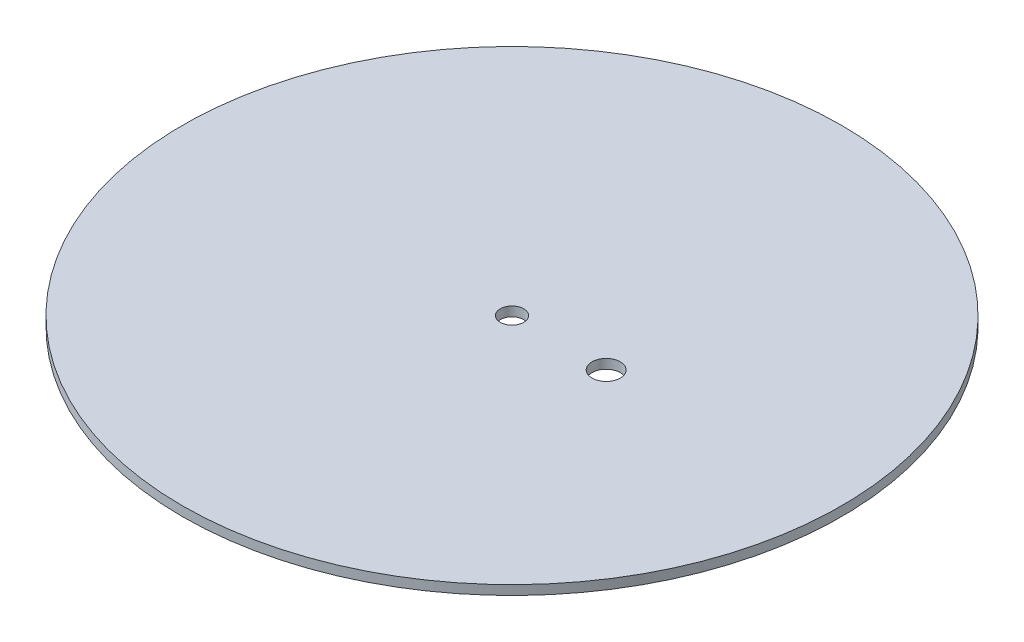
from build123d import *

# Parameters (mm, degrees)
SKETCH1_R           = 70
BOSS_EXTRUDE1_DEPTH = 2
SKETCH3_R           = 2.5
SKETCH3_R_2         = 3
CUT_EXTRUDE1_DEPTH  = 100.015150356


with BuildPart() as part:
    # Sketch1 → Boss-Extrude1 (new body)
    with BuildSketch(Plane(origin=(0, 0, 0), x_dir=(1, 0, 0), z_dir=(0, 1, 0))):
        Circle(SKETCH1_R)
    extrude(amount=BOSS_EXTRUDE1_DEPTH)

    # Sketch3 → Cut-Extrude1 (cut, through all)
    with BuildSketch(Plane(origin=(0, 2, 0), x_dir=(1, 0, 0), z_dir=(0, 1, 0))):
        Circle(SKETCH3_R)
        with Locations((20, 0)):
            Circle(SKETCH3_R_2)
    extrude(amount=-CUT_EXTRUDE1_DEPTH, mode=Mode.SUBTRACT)


solid = part.part
